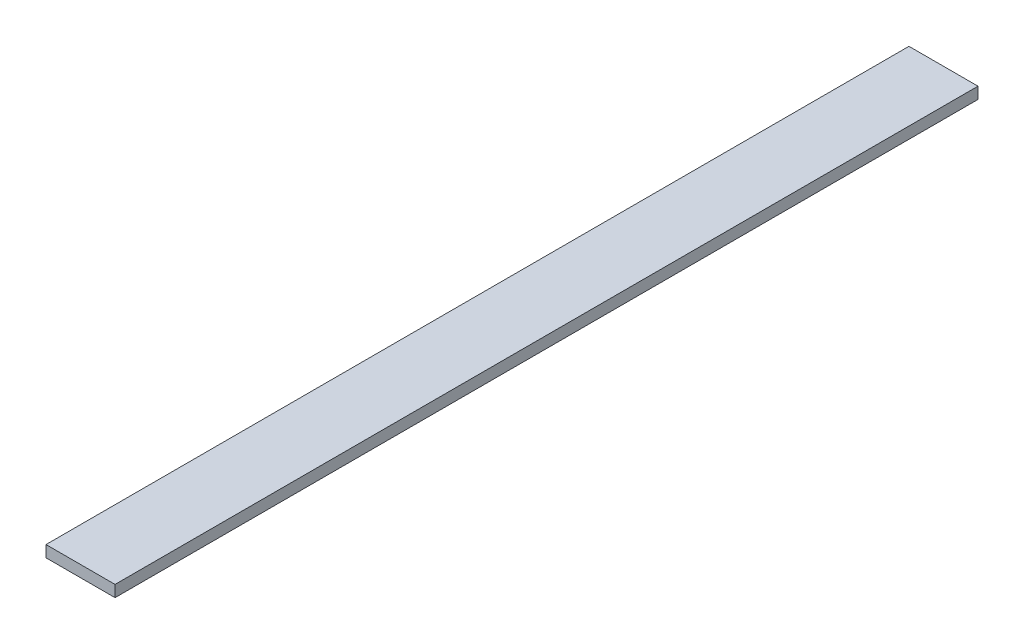
from build123d import *

# Parameters (mm, degrees)
SKETCH1_W           = 48
SKETCH1_H           = 600
BOSS_EXTRUDE1_DEPTH = 8


with BuildPart() as part:
    # Sketch1 → Boss-Extrude1 (new body)
    with BuildSketch(Plane(origin=(0, 0, 0), x_dir=(1, 0, 0), z_dir=(0, 1, 0))):
        with Locations((24, 300)):
            Rectangle(SKETCH1_W, SKETCH1_H)
    extrude(amount=BOSS_EXTRUDE1_DEPTH)


solid = part.part
